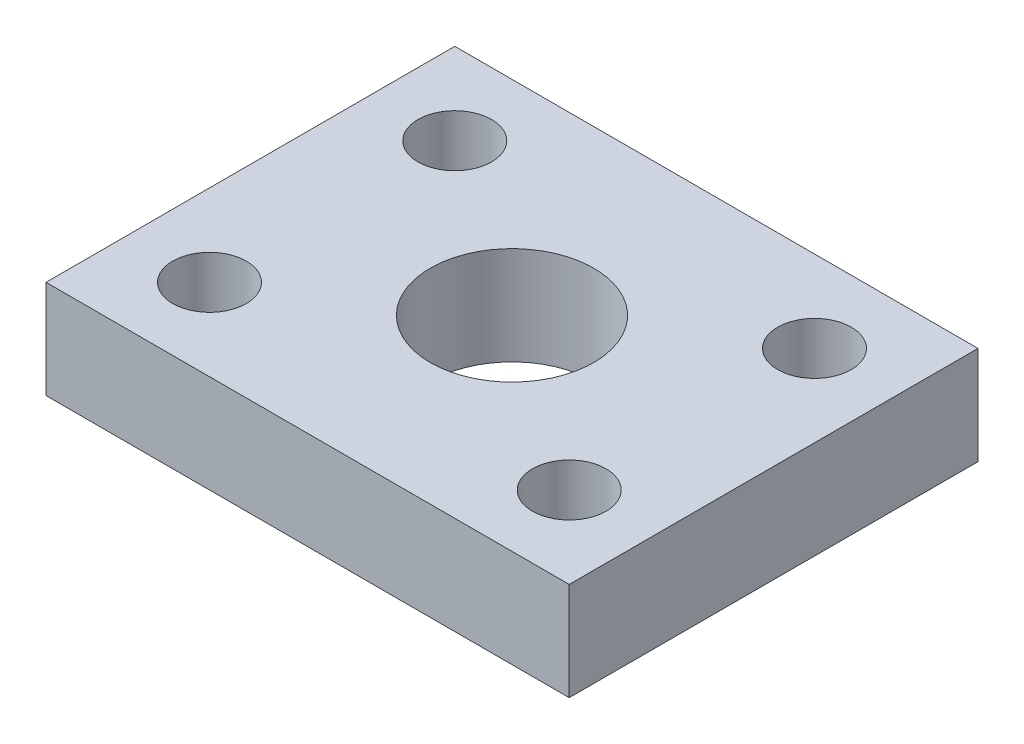
from build123d import *

# Parameters (mm, degrees)
SKETCH1_W           = 32
SKETCH1_H           = 25
SKETCH1_R           = 2.25
SKETCH1_R_2         = 5
BOSS_EXTRUDE1_DEPTH = 6


with BuildPart() as part:
    # Sketch1 → Boss-Extrude1 (new body)
    with BuildSketch(Plane(origin=(0, 0, 0), x_dir=(1, 0, 0), z_dir=(0, 1, 0))):
        Rectangle(SKETCH1_W, SKETCH1_H)
        with Locations(Location((11, 7.5, 0), (0, 0, 270))):
            Circle(SKETCH1_R, mode=Mode.SUBTRACT)
        with Locations(Location((11, -7.5, 0), (0, 0, 270))):
            Circle(SKETCH1_R, mode=Mode.SUBTRACT)
        with Locations(Location((-11, -7.5, 0), (0, 0, 270))):
            Circle(SKETCH1_R, mode=Mode.SUBTRACT)
        with Locations(Location((-11, 7.5, 0), (0, 0, 270))):
            Circle(SKETCH1_R, mode=Mode.SUBTRACT)
        with Locations(Location((0, 0, 0), (0, 0, 270))):
            Circle(SKETCH1_R_2, mode=Mode.SUBTRACT)
    extrude(amount=BOSS_EXTRUDE1_DEPTH)


solid = part.part
